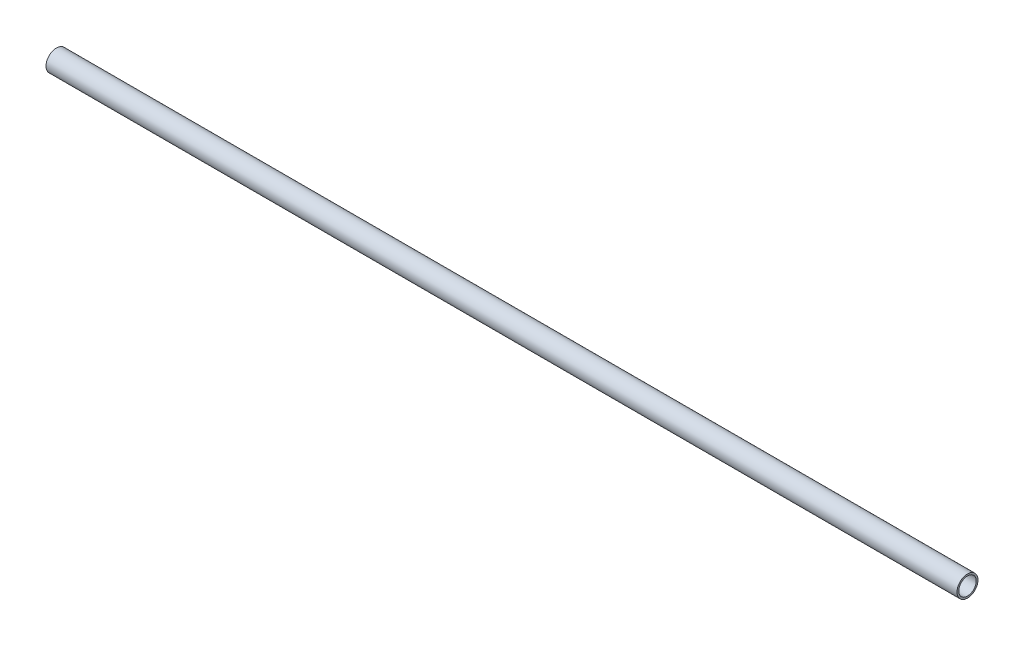
from build123d import *

# Parameters (mm, degrees)
BOSS_EXTRUDE1_DEPTH      = 914.4
BOSS_EXTRUDE1_DEPTH_BACK = 914.4
SKETCH1_R                = 21.082
SKETCH1_R_2              = 17.526
SKETCH2_R                = 3.175
CUT_EXTRUDE1_DEPTH       = 915.885928107


with BuildPart() as part:
    # Sketch1 → Boss-Extrude1 (new, two sides: drawn at the far end of the back side and taken through both)
    with BuildSketch(Plane(origin=(0, 0, 0), x_dir=(0, 0, -1), z_dir=(1, 0, 0)).offset(-BOSS_EXTRUDE1_DEPTH_BACK)):
        Circle(SKETCH1_R)
        Circle(SKETCH1_R_2, mode=Mode.SUBTRACT)
    extrude(amount=BOSS_EXTRUDE1_DEPTH + BOSS_EXTRUDE1_DEPTH_BACK)

    # Sketch2 → Cut-Extrude1 (cut, through all)
    with BuildSketch(Plane.XY):
        with Locations((-831.85, 0)):
            Circle(SKETCH2_R)
        with Locations((-882.65, 0)):
            Circle(SKETCH2_R)
    cut_extrude1 = extrude(amount=-CUT_EXTRUDE1_DEPTH, mode=Mode.SUBTRACT)

    # Mirror1: Cut-Extrude1 across plane
    add(cut_extrude1.mirror(Plane(origin=(0, 0, 0), x_dir=(0, 0, 1), z_dir=(1, 0, 0))), mode=Mode.SUBTRACT)


solid = part.part
